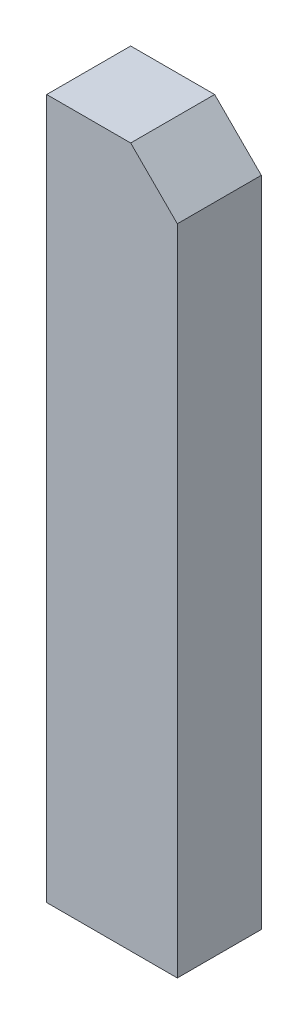
from build123d import *

# Parameters (mm, degrees)
SKETCH2_W           = 2.8
SKETCH2_H           = 1.8
BOSS_EXTRUDE1_DEPTH = 15
CHAMFER1_SIZE       = 1


with BuildPart() as part:
    # Sketch2 → Boss-Extrude1 (new body)
    with BuildSketch(Plane(origin=(0, 0, 0), x_dir=(1, 0, 0), z_dir=(0, 1, 0))):
        Rectangle(SKETCH2_W, SKETCH2_H)
    extrude(amount=BOSS_EXTRUDE1_DEPTH)

    # Chamfer1
    chamfer1_edges = [part.edges().sort_by_distance(p)[0] for p in [
        (1.4, 15, 0),
    ]]
    chamfer(chamfer1_edges, length=CHAMFER1_SIZE)


solid = part.part
